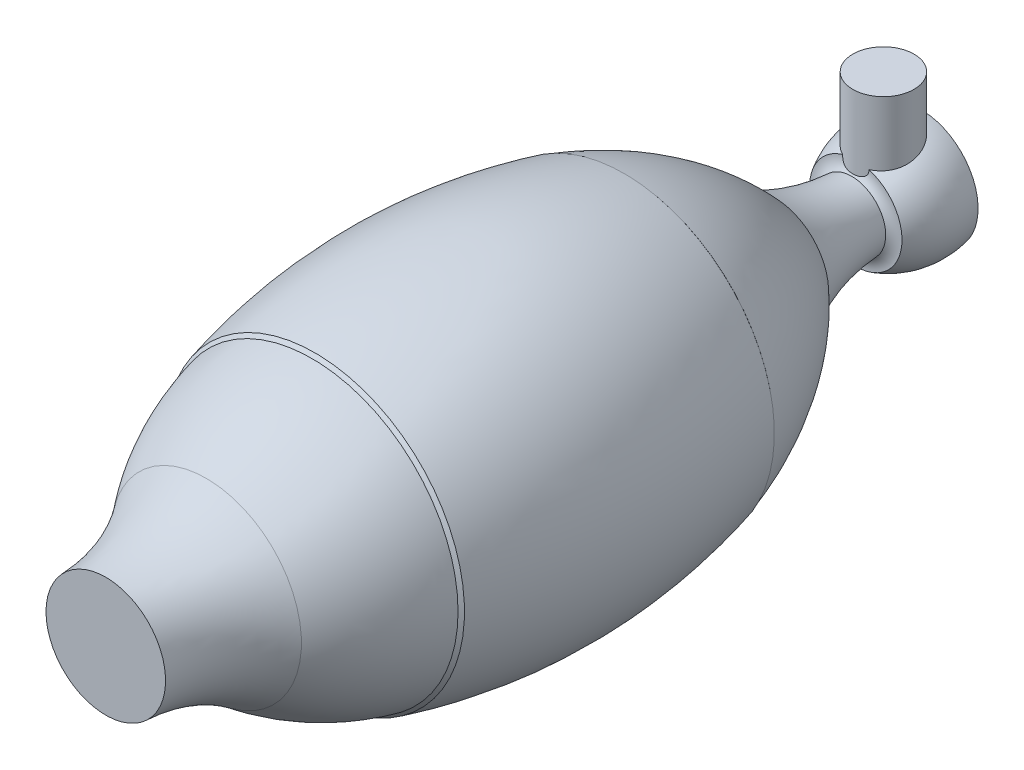
from build123d import *

# Parameters (mm, degrees)
CROQUIS3_R              = 11.254938513
SALIENTE_EXTRUIR1_DEPTH = 40


with BuildPart() as part:
    # Croquis2 → Revolución1 (revolve)
    with BuildSketch(Plane(origin=(0, 0, 0), x_dir=(0, 0, -1), z_dir=(1, 0, 0)), mode=Mode.PRIVATE) as revoluci_n1_sk:
        with BuildLine():
            Line((150, 0), (-150, 0))
            Line((-150, 0), (-150, 22))
            add(Edge.make_bspline(
                [(-150, 22), (-129.37122853, 22.885622181), (-113, 35)],
                knots=[0, 0, 0, 1, 1, 1], degree=2))
            add(Edge.make_bspline(
                [(-113, 35), (-95.881812415, 48.646741744), (-74.132716714, 53.766097155)],
                knots=[0, 0, 0, 1, 1, 1], degree=2))
            Line((-74.132716714, 53.766097155), (-73, 55))
            add(Edge.make_bspline(
                [(-73, 55), (-16.299719206, 70.007388518), (40.792726285, 55.238800573)],
                knots=[0, 0, 0, 1, 1, 1], degree=2))
            Line((40.792726285, 55.238800573), (41, 55))
            add(Edge.make_bspline(
                [(96, 20), (73.639957347, 44.758097736), (41, 55)],
                knots=[0, 0, 0, 1, 1, 1], degree=2))
            add(Edge.make_bspline(
                [(96, 20), (109.456952534, 13.416291924), (124.5, 12.5)],
                knots=[0, 0, 0, 1, 1, 1], degree=2))
            add(Edge.make_bspline(
                [(124.5, 12.5), (126.032905764, 14.43367106), (126, 17)],
                knots=[0, 0, 0, 1, 1, 1], degree=2))
            add(Edge.make_bspline(
                [(126, 17), (137.156021006, 23.491935887), (150, 21)],
                knots=[0, 0, 0, 1, 1, 1], degree=2))
            Line((150, 21), (150, 0))
        make_face()
    revolve(revoluci_n1_sk.sketch.rotate(Axis((0, 0, -150), (0, 0, 1)), 90), axis=Axis((0, 0, -150), (0, 0, 1)))

    # Croquis3 → Saliente-Extruir1 (add)
    with BuildSketch(Plane(origin=(0, 0, 0), x_dir=(1, 0, 0), z_dir=(0, 1, 0))):
        with Locations(Location((0, 136.160191659, 0), (0, 0, 56.874015027))):
            Circle(CROQUIS3_R)
    extrude(amount=SALIENTE_EXTRUIR1_DEPTH)


solid = part.part
